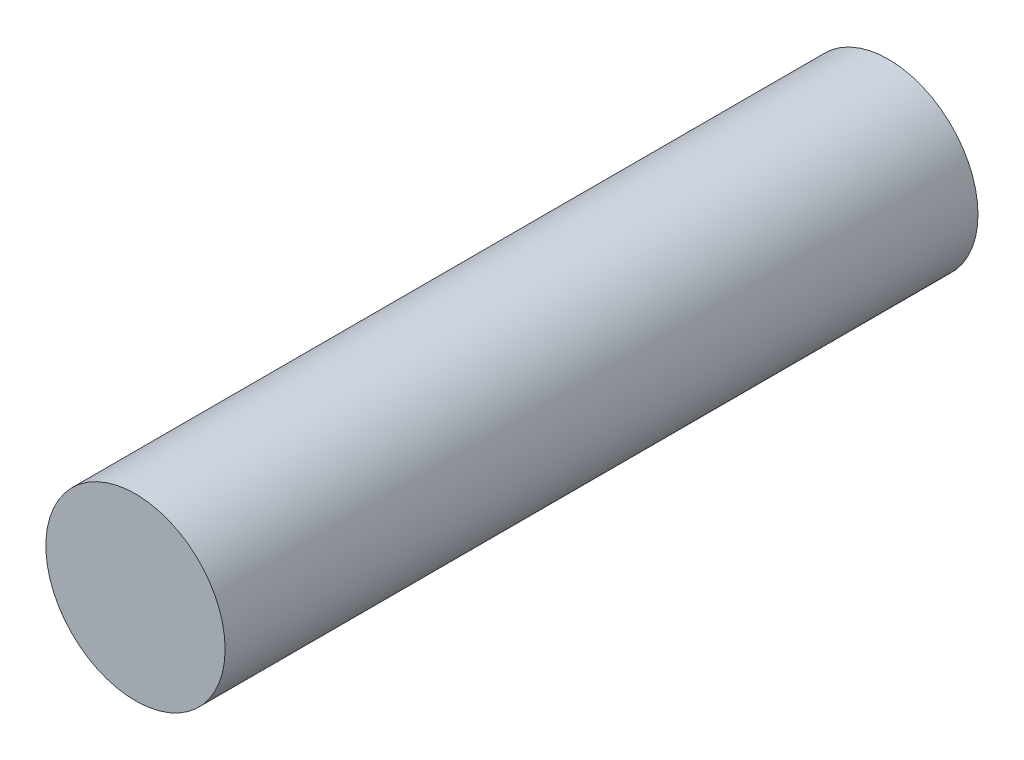
from build123d import *

# Parameters (mm, degrees)
BOSS_EXTRUDE1_DEPTH = 20


with BuildPart() as part:
    # Sketch1 → Boss-Extrude1 (new, symmetric)
    with BuildSketch(Plane.XY):
        with BuildLine():
            ThreePointArc((4.7625, 0), (4.12444598, 2.381250009), (2.381249982, 4.124445996))
            ThreePointArc((2.381249982, 4.124445996), (-4.1e-08, 4.7625), (-2.381250053, 4.124445955))
            ThreePointArc((-2.381250053, 4.124445955), (-4.124446001, 2.381249973), (-4.7625, 0))
            ThreePointArc((-4.7625, 0), (-4.124445947, -2.381250067), (-2.381249866, -4.124446063))
            ThreePointArc((-2.381249866, -4.124446063), (7.9e-08, -4.7625), (2.381250004, -4.124445983))
            ThreePointArc((2.381250004, -4.124445983), (4.124445987, -2.381249998), (4.7625, 0))
        make_face()
    extrude(amount=BOSS_EXTRUDE1_DEPTH, both=True)


solid = part.part
